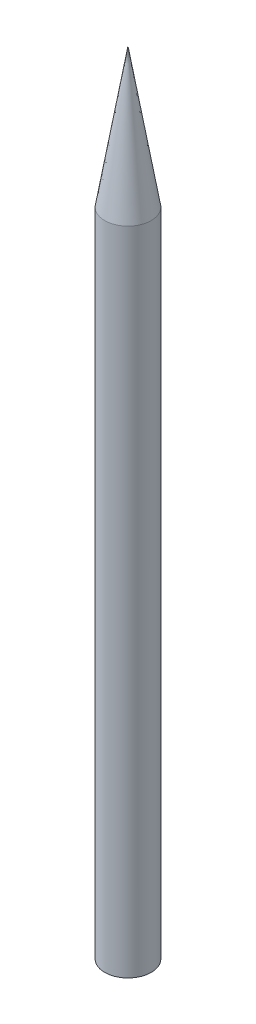
from build123d import *

# Parameters (mm, degrees)
SKETCH1_R           = 3.175
BOSS_EXTRUDE1_DEPTH = 88.9


with BuildPart() as part:
    # Sketch1 → Boss-Extrude1 (new body)
    with BuildSketch(Plane(origin=(0, 0, 0), x_dir=(1, 0, 0), z_dir=(0, 1, 0))):
        with Locations(Location((0, 0, 0), (0, 0, 270))):
            Circle(SKETCH1_R)
    extrude(amount=BOSS_EXTRUDE1_DEPTH)

    # Sketch3 → Revolve1 (revolve)
    with BuildSketch(Plane.XY, mode=Mode.PRIVATE) as revolve1_sk:
        Polygon((-3.175, 88.9), (0, 107.95), (0, 88.9), align=None)
    revolve(revolve1_sk.sketch.rotate(Axis((0, 88.9, 0), (0, 1, 0)), 270), axis=Axis((0, 88.9, 0), (0, 1, 0)))


solid = part.part
